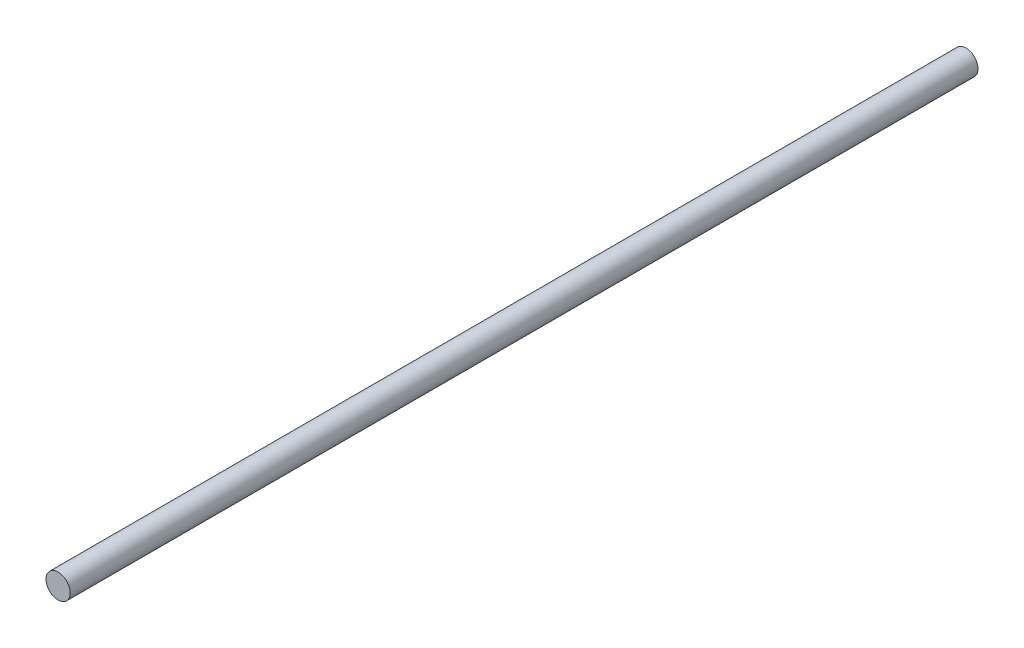
from build123d import *

# Parameters (mm, degrees)
SKETCH2_R           = 1
BOSS_EXTRUDE1_DEPTH = 37.5


with BuildPart() as part:
    # Sketch2 → Boss-Extrude1 (new, symmetric)
    with BuildSketch(Plane.XY):
        Circle(SKETCH2_R)
    extrude(amount=BOSS_EXTRUDE1_DEPTH, both=True)


solid = part.part
